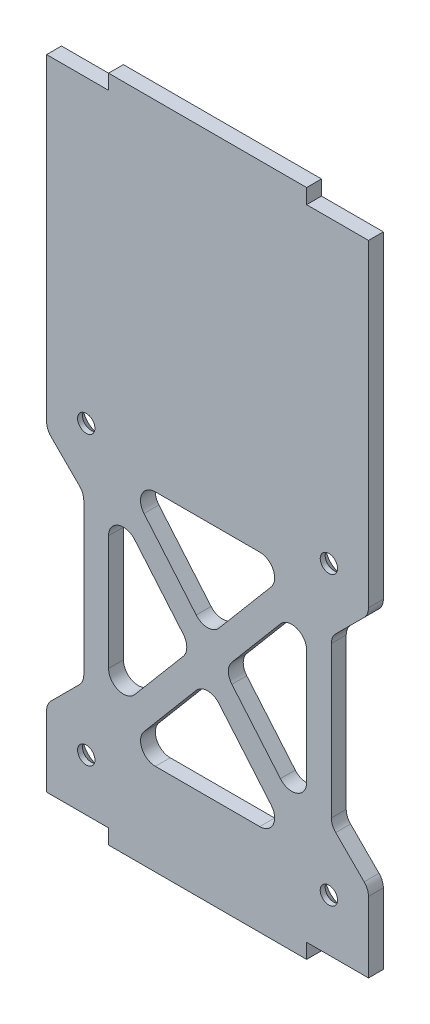
from build123d import *

# Parameters (mm, degrees)
SKETCH_1_W          = 65
SKETCH_1_H          = 129
SKETCH_1_W_2        = 40
SKETCH_1_H_2        = 6
EXTRUDE_1_DEPTH     = 3
SKETCH_2_R          = 1.75
CUT_EXTRUDE_1_DEPTH = 10
CHAMFER_1_SIZE      = 2
CUT_EXTRUDE_2_DEPTH = 10
FILLET_1_R          = 3
FILLET_2_R          = 3
FILLET_3_R          = 3


with BuildPart() as part:
    # Эскиз1 → Бобышка-Вытянуть1 (new body)
    with BuildSketch(Plane.XY):
        Rectangle(SKETCH_1_W, SKETCH_1_H)
        with Locations((0, 64.5)):
            Rectangle(SKETCH_1_W_2, SKETCH_1_H_2)
        with Locations((0, -64.5)):
            Rectangle(SKETCH_1_W_2, SKETCH_1_H_2)
    extrude(amount=EXTRUDE_1_DEPTH)

    # Эскиз2 → Вырез-Вытянуть1 (cut)
    with BuildSketch(Plane.XY.offset(3)):
        with Locations((-24.5, 4)):
            Circle(SKETCH_2_R)
        with Locations((24.5, 4)):
            Circle(SKETCH_2_R)
        with Locations((24.5, -54)):
            Circle(SKETCH_2_R)
        with Locations((-24.5, -54)):
            Circle(SKETCH_2_R)
    extrude(amount=-CUT_EXTRUDE_1_DEPTH, mode=Mode.SUBTRACT)

    # Фаска1
    chamfer_1_edges = [part.edges().sort_by_distance(p)[0] for p in [
        (-26.25, -54, 0),
        (22.75, -54, 0),
        (22.75, 4, 0),
        (-26.25, 4, 0),
    ]]
    chamfer(chamfer_1_edges, length=CHAMFER_1_SIZE)

    # Эскиз3 → Вырез-Вытянуть2 (cut)
    with BuildSketch(Plane(origin=(0, 0, 0), x_dir=(-1, 0, 0), z_dir=(0, 0, -1))):
        Polygon((32.5, -1), (25, -8.5), (25, -41.5), (32.5, -49), (35.92761887, -49), (35.92761887, -1), align=None)
        Polygon((-35.92761887, -49), (-32.5, -49), (-25, -41.5), (-25, -8.5), (-32.5, -1), (-35.92761887, -1), align=None)
        Polygon((0, -21.126143006), (-17.003120815, -1), (17.003120815, -1), align=None)
        Polygon((20, -5.200387607), (3.272741254, -25), (20, -44.799612393), align=None)
        Polygon((17.003120815, -49), (0, -28.873856994), (-17.003120815, -49), align=None)
        Polygon((-20, -5.200387607), (-20, -44.799612393), (-3.272741254, -25), align=None)
    extrude(amount=-CUT_EXTRUDE_2_DEPTH, mode=Mode.SUBTRACT)

    # Скругление1
    fillet_1_edges = [part.edges().sort_by_distance(p)[0] for p in [
        (-32.5, -1, 1.5),
        (-32.5, -49, 1.5),
        (-25, -41.5, 1.5),
        (-25, -8.5, 1.5),
    ]]
    fillet(fillet_1_edges, radius=FILLET_1_R)

    # Скругление2
    fillet_2_edges = [part.edges().sort_by_distance(p)[0] for p in [
        (32.5, -1, 1.5),
        (25, -8.5, 1.5),
        (25, -41.5, 1.5),
        (32.5, -49, 1.5),
    ]]
    fillet(fillet_2_edges, radius=FILLET_2_R)

    # Скругление3
    fillet_3_edges = [part.edges().sort_by_distance(p)[0] for p in [
        (17.003120815, -49, 1.5),
        (0, -28.873856994, 1.5),
        (-17.003120815, -49, 1.5),
        (-20, -44.799612393, 1.5),
        (-3.272741254, -25, 1.5),
        (-20, -5.200387607, 1.5),
        (3.272741254, -25, 1.5),
        (20, -44.799612393, 1.5),
        (20, -5.200387607, 1.5),
        (-17.003120815, -1, 1.5),
        (0, -21.126143006, 1.5),
        (17.003120815, -1, 1.5),
    ]]
    fillet(fillet_3_edges, radius=FILLET_3_R)


solid = part.part
